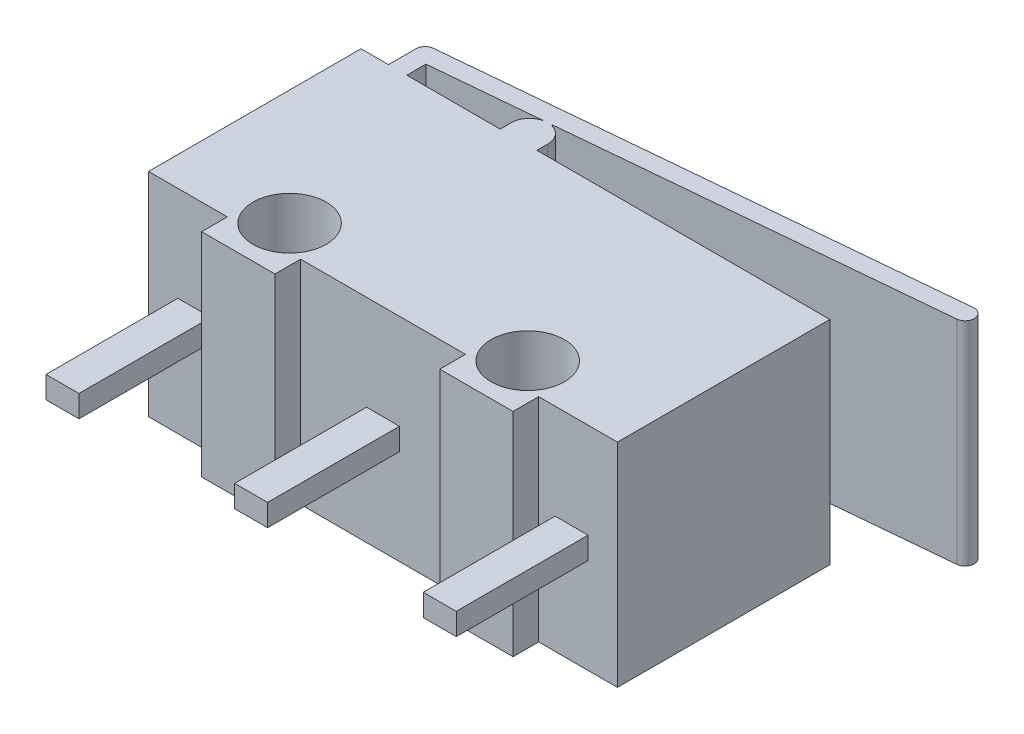
from build123d import *

# Parameters (mm, degrees)
SKETCH1_R           = 1
BOSS_EXTRUDE1_DEPTH = 5.8
SKETCH3_W           = 0.9
SKETCH3_H           = 0.6
BOSS_EXTRUDE2_DEPTH = 3.6


with BuildPart() as part:
    # Sketch1 → Boss-Extrude1 (new body)
    with BuildSketch(Plane(origin=(0, 0, 0), x_dir=(1, 0, 0), z_dir=(0, 1, 0))):
        with BuildLine():
            ThreePointArc((-1.6, 3.2), (-1.7066364, 3.508650414), (-1.981060312, 3.685647352))
            Line((-1.981060312, 3.685647352), (-1.981060312, 3.713031937))
            Line((-1.981060312, 3.713031937), (8.122870222, 4.641240594))
            ThreePointArc((8.122870222, 4.641240594), (8.348951708, 4.913062524), (8.077129778, 5.13914401))
            Line((8.077129778, 5.13914401), (-5.422870222, 3.898951708))
            ThreePointArc((-5.422870222, 3.898951708), (-5.584685619, 3.81849695), (-5.65, 3.65))
            Line((-5.65, 3.65), (-5.65, 2.9))
            Line((-5.65, 2.9), (-6.4, 2.9))
            Line((-6.4, 2.9), (-6.4, -2.9))
            Line((-6.4, -2.9), (-4.25, -2.9))
            Line((-4.25, -2.9), (-4.25, -3.6))
            Line((-4.25, -3.6), (-2.25, -3.6))
            Line((-2.25, -3.6), (-2.25, -2.9))
            Line((-2.25, -2.9), (2.25, -2.9))
            Line((2.25, -2.9), (2.25, -3.6))
            Line((2.25, -3.6), (4.25, -3.6))
            Line((4.25, -3.6), (4.25, -2.9))
            Line((4.25, -2.9), (6.4, -2.9))
            Line((6.4, -2.9), (6.4, 2.9))
            Line((6.4, 2.9), (-1.6, 2.9))
            Line((-1.6, 2.9), (-1.6, 3.2))
        make_face()
        with Locations(Location((-3.25, -2.2, 0), (0, 0, 270))):
            Circle(SKETCH1_R, mode=Mode.SUBTRACT)
        with Locations(Location((3.25, -2.2, 0), (0, 0, 270))):
            Circle(SKETCH1_R, mode=Mode.SUBTRACT)
        with BuildLine():
            Line((-2.218939688, 3.691178887), (-2.218939688, 3.685647352))
            ThreePointArc((-2.218939688, 3.685647352), (-2.4933636, 3.508650414), (-2.6, 3.2))
            Line((-2.6, 3.2), (-2.6, 2.9))
            Line((-2.6, 2.9), (-5.15, 2.9))
            Line((-5.15, 2.9), (-5.15, 3.421913818))
            Line((-5.15, 3.421913818), (-2.218939688, 3.691178887))
        make_face(mode=Mode.SUBTRACT)
    extrude(amount=BOSS_EXTRUDE1_DEPTH)

    # Sketch3 → Boss-Extrude2 (add)
    with BuildSketch(Plane.XY.offset(2.9)):
        with Locations((-5.15, 2.9)):
            Rectangle(SKETCH3_W, SKETCH3_H)
        with Locations((0, 2.9)):
            Rectangle(SKETCH3_W, SKETCH3_H)
        with Locations((5.15, 2.9)):
            Rectangle(SKETCH3_W, SKETCH3_H)
    extrude(amount=BOSS_EXTRUDE2_DEPTH)


solid = part.part
